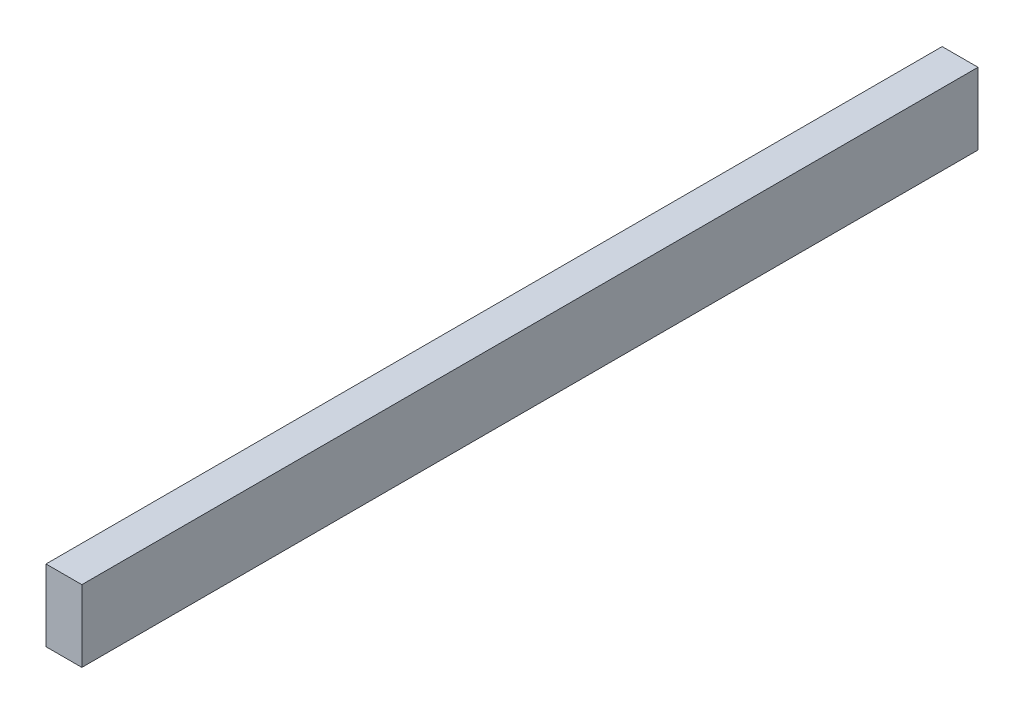
from build123d import *

# Parameters (mm, degrees)
SKETCH_1_W      = 40
SKETCH_1_H      = 80
EXTRUDE_1_DEPTH = 1000


with BuildPart() as part:
    # 草图1 → 凸台-拉伸1 (new body)
    with BuildSketch(Plane.XY):
        Rectangle(SKETCH_1_W, SKETCH_1_H)
    extrude(amount=EXTRUDE_1_DEPTH)


solid = part.part
